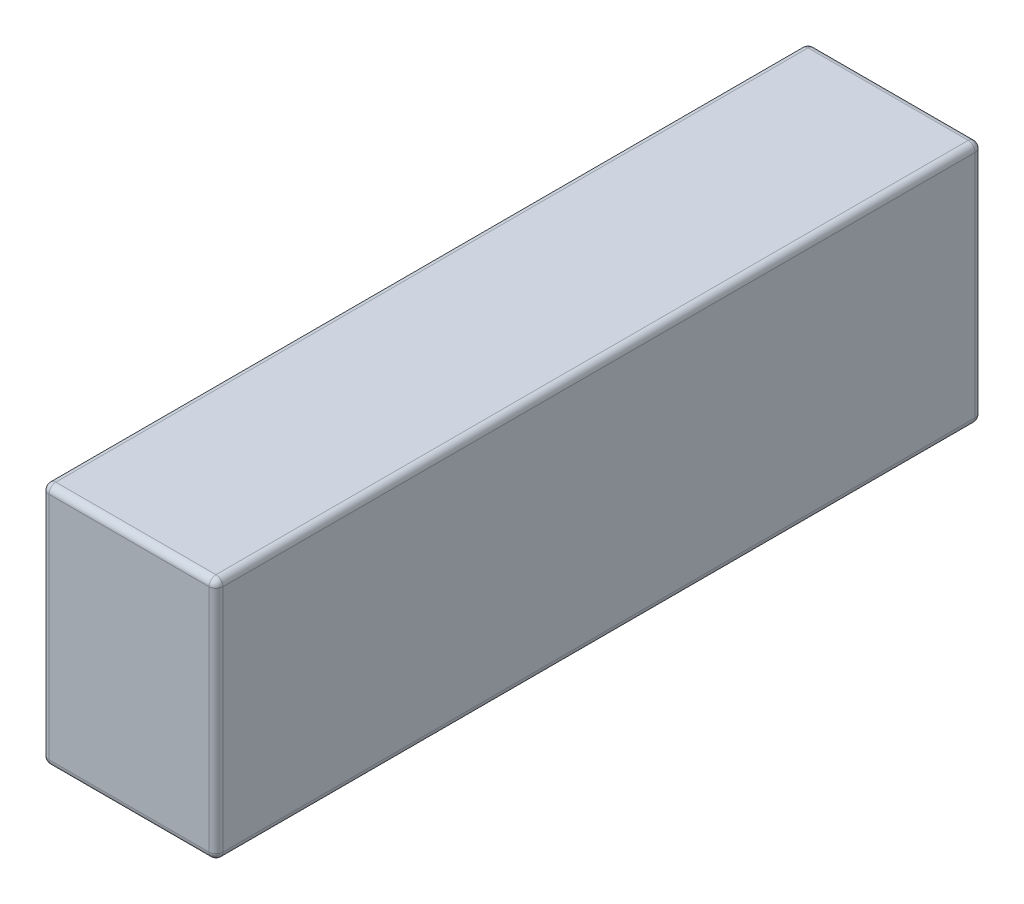
from build123d import *

# Parameters (mm, degrees)
SKETCH1_W           = 25
SKETCH1_H           = 110
BOSS_EXTRUDE1_DEPTH = 35
FILLET1_R           = 1


with BuildPart() as part:
    # Sketch1 → Boss-Extrude1 (new body)
    with BuildSketch(Plane(origin=(0, 0, 0), x_dir=(1, 0, 0), z_dir=(0, 1, 0))):
        Rectangle(SKETCH1_W, SKETCH1_H)
    extrude(amount=BOSS_EXTRUDE1_DEPTH)

    # Fillet1
    fillet1_edges = [part.edges().sort_by_distance(p)[0] for p in [
        (12.5, 35, 0),
        (0, 35, -55),
        (-12.5, 35, 0),
        (0, 0, -55),
        (12.5, 0, 0),
        (0, 0, 55),
        (-12.5, 0, 0),
        (0, 35, 55),
        (-12.5, 17.5, -55),
        (12.5, 17.5, -55),
        (12.5, 17.5, 55),
        (-12.5, 17.5, 55),
    ]]
    fillet(fillet1_edges, radius=FILLET1_R)


solid = part.part
